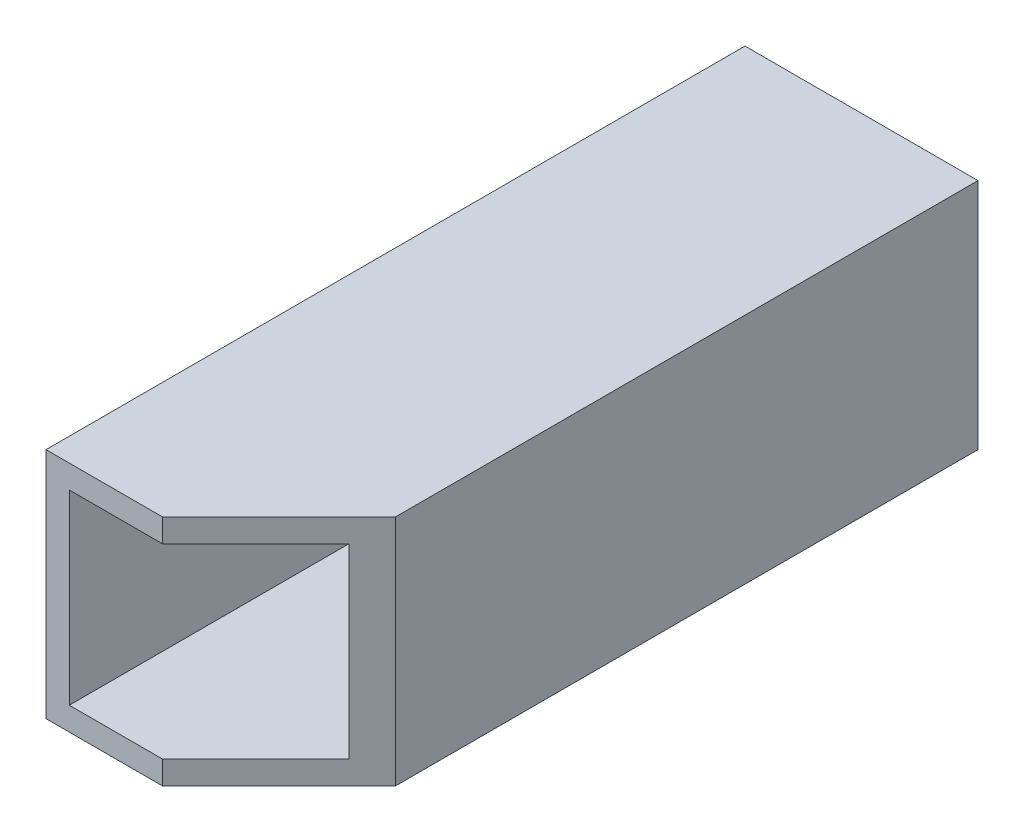
from build123d import *

# Parameters (mm, degrees)
SKETCH2_W           = 50
SKETCH2_H           = 50
SKETCH2_W_2         = 40
SKETCH2_H_2         = 40
BOSS_EXTRUDE1_DEPTH = 150
CUT_EXTRUDE1_DEPTH  = 161.078105936


with BuildPart() as part:
    # Sketch2 → Boss-Extrude1 (new body)
    with BuildSketch(Plane(origin=(0, 0, 0), x_dir=(1, 0, 0), z_dir=(0, 0, -1))):
        Rectangle(SKETCH2_W, SKETCH2_H)
        Rectangle(SKETCH2_W_2, SKETCH2_H_2, mode=Mode.SUBTRACT)
    extrude(amount=-BOSS_EXTRUDE1_DEPTH)

    # Sketch3 → Cut-Extrude1 (cut, through all)
    with BuildSketch(Plane.XZ.offset(25)):
        Polygon((0, 150), (25, 125), (25, 150), align=None)
    extrude(amount=-CUT_EXTRUDE1_DEPTH, mode=Mode.SUBTRACT)


solid = part.part
